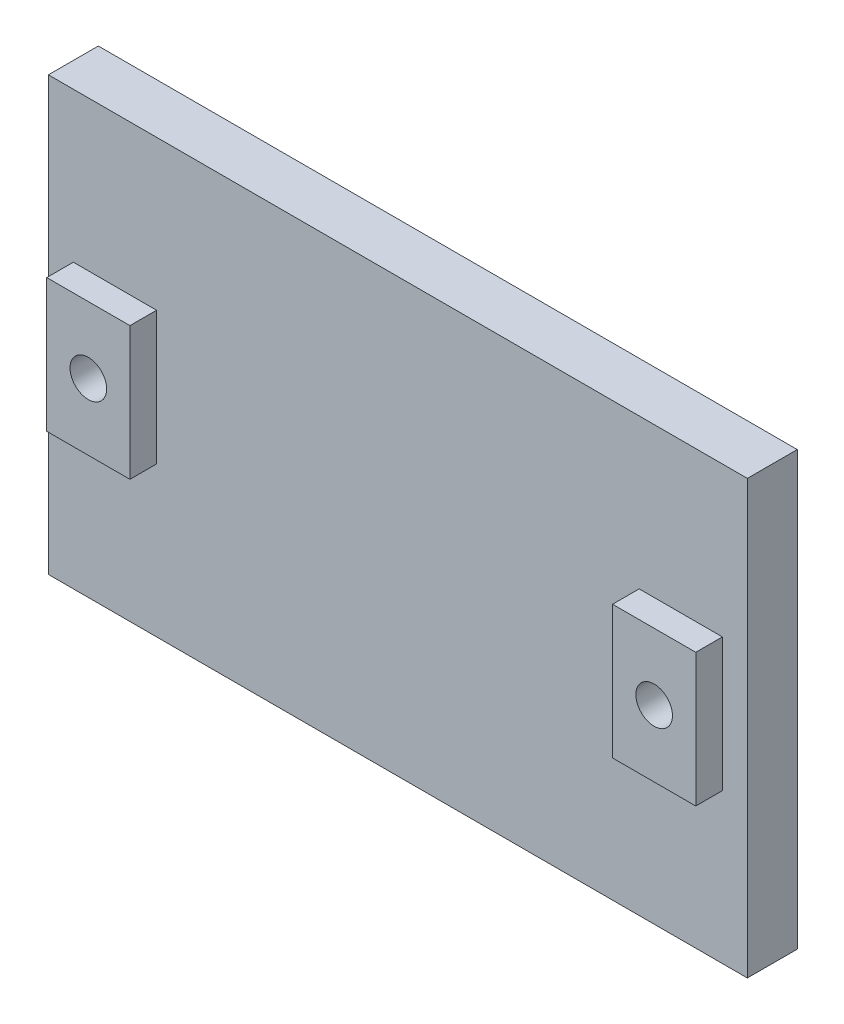
from build123d import *

# Parameters (mm, degrees)
MOUNTING_PLATE_SKETCH_W       = 42
MOUNTING_PLATE_SKETCH_H       = 26
MOUNTING_PLATE_DEPTH          = 3
CLAMP_SEAT_1_SKETCH_W         = 5
CLAMP_SEAT_1_SKETCH_H         = 8
CLAMP_SEAT_1_DEPTH            = 1.7
M2_SCREW_CLEARANCE_1_SKETCH_R = 1.1
M2_SCREW_CLEARANCE_1_DEPTH    = 4.8
M2_INSERT_POCKET_1_SKETCH_R   = 1.6
M2_INSERT_POCKET_1_DEPTH      = 2.5
CLAMP_SEAT_2_SKETCH_W         = 5
CLAMP_SEAT_2_SKETCH_H         = 8
CLAMP_SEAT_2_DEPTH            = 1.7
M2_SCREW_CLEARANCE_2_SKETCH_R = 1.1
M2_SCREW_CLEARANCE_2_DEPTH    = 4.8
M2_INSERT_POCKET_2_SKETCH_R   = 1.6
M2_INSERT_POCKET_2_DEPTH      = 2.5


with BuildPart() as part:
    # Mounting Plate Sketch → Mounting Plate (new body)
    with BuildSketch(Plane.XY):
        Rectangle(MOUNTING_PLATE_SKETCH_W, MOUNTING_PLATE_SKETCH_H)
    extrude(amount=MOUNTING_PLATE_DEPTH)

    # Clamp Seat 1 Sketch → Clamp Seat 1 (add)
    with BuildSketch(Plane.XY.offset(2.9)):
        with Locations((-17, 0)):
            Rectangle(CLAMP_SEAT_1_SKETCH_W, CLAMP_SEAT_1_SKETCH_H)
    extrude(amount=CLAMP_SEAT_1_DEPTH)

    # M2 Screw Clearance 1 Sketch → M2 Screw Clearance 1 (cut)
    with BuildSketch(Plane.XY.offset(-0.1)):
        with Locations((-17, 0)):
            Circle(M2_SCREW_CLEARANCE_1_SKETCH_R)
    extrude(amount=M2_SCREW_CLEARANCE_1_DEPTH, mode=Mode.SUBTRACT)

    # M2 Insert Pocket 1 Sketch → M2 Insert Pocket 1 (cut)
    with BuildSketch(Plane.XY.offset(-0.1)):
        with Locations((-17, 0)):
            Circle(M2_INSERT_POCKET_1_SKETCH_R)
    extrude(amount=M2_INSERT_POCKET_1_DEPTH, mode=Mode.SUBTRACT)

    # Clamp Seat 2 Sketch → Clamp Seat 2 (add)
    with BuildSketch(Plane.XY.offset(2.9)):
        with Locations((17, 0)):
            Rectangle(CLAMP_SEAT_2_SKETCH_W, CLAMP_SEAT_2_SKETCH_H)
    extrude(amount=CLAMP_SEAT_2_DEPTH)

    # M2 Screw Clearance 2 Sketch → M2 Screw Clearance 2 (cut)
    with BuildSketch(Plane.XY.offset(-0.1)):
        with Locations((17, 0)):
            Circle(M2_SCREW_CLEARANCE_2_SKETCH_R)
    extrude(amount=M2_SCREW_CLEARANCE_2_DEPTH, mode=Mode.SUBTRACT)

    # M2 Insert Pocket 2 Sketch → M2 Insert Pocket 2 (cut)
    with BuildSketch(Plane.XY.offset(-0.1)):
        with Locations((17, 0)):
            Circle(M2_INSERT_POCKET_2_SKETCH_R)
    extrude(amount=M2_INSERT_POCKET_2_DEPTH, mode=Mode.SUBTRACT)


solid = part.part
